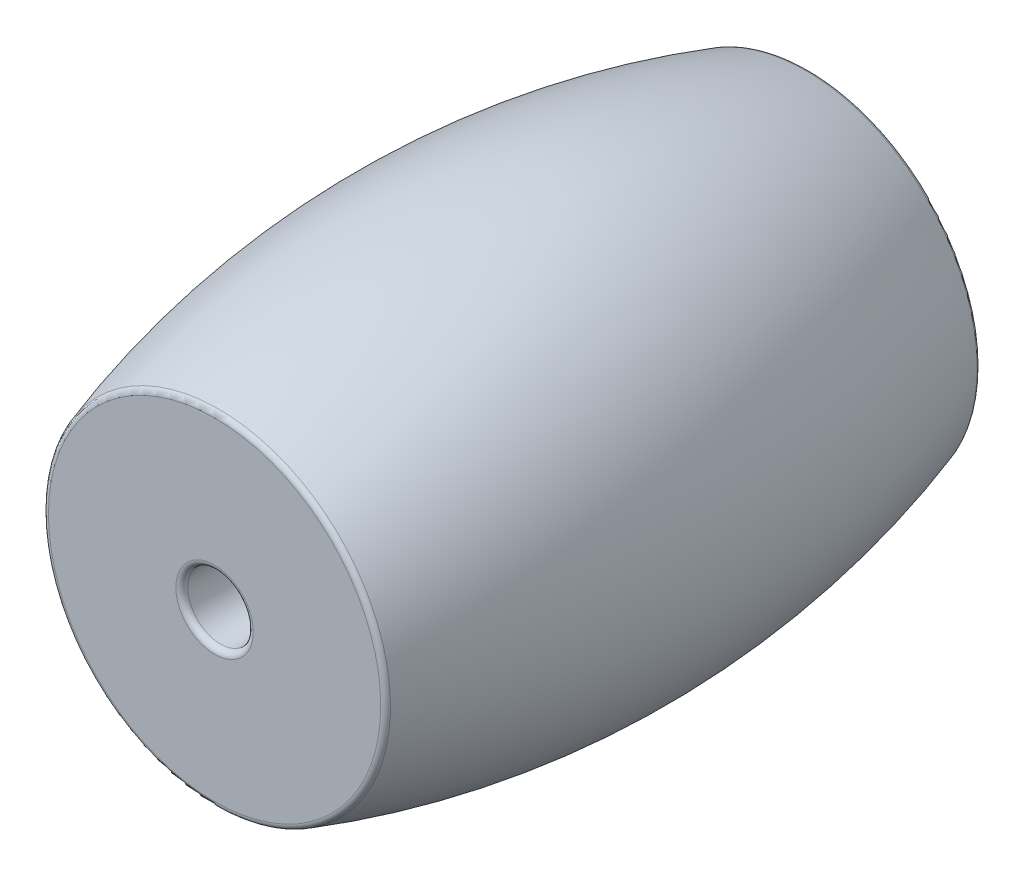
from build123d import *

# Parameters (mm, degrees)
VERRUNDUNG1_R = 0.3


with BuildPart() as part:
    # Skizze1 → Rotation3 (revolve)
    with BuildSketch(Plane(origin=(0, 0, 0), x_dir=(0, 0, -1), z_dir=(1, 0, 0)), mode=Mode.PRIVATE) as rotation3_sk:
        with BuildLine():
            ThreePointArc((15, 8.596052461), (0, 11), (-15, 8.596052461))
            Line((-15, 8.596052461), (-15, 1.65))
            Line((-15, 1.65), (15, 1.65))
            Line((15, 1.65), (15, 8.596052461))
        make_face()
    revolve(rotation3_sk.sketch.rotate(Axis((0, 0, 31.772981832), (0, 0, -1)), 90), axis=Axis((0, 0, 31.772981832), (0, 0, -1)))

    # Verrundung1
    verrundung1_edges = [part.edges().sort_by_distance(p)[0] for p in [
        (-1.65, 0, -15),
        (-1.65, 0, 15),
        (-8.596052461, 0, 15),
        (-8.596052461, 0, -15),
    ]]
    fillet(verrundung1_edges, radius=VERRUNDUNG1_R)


solid = part.part
